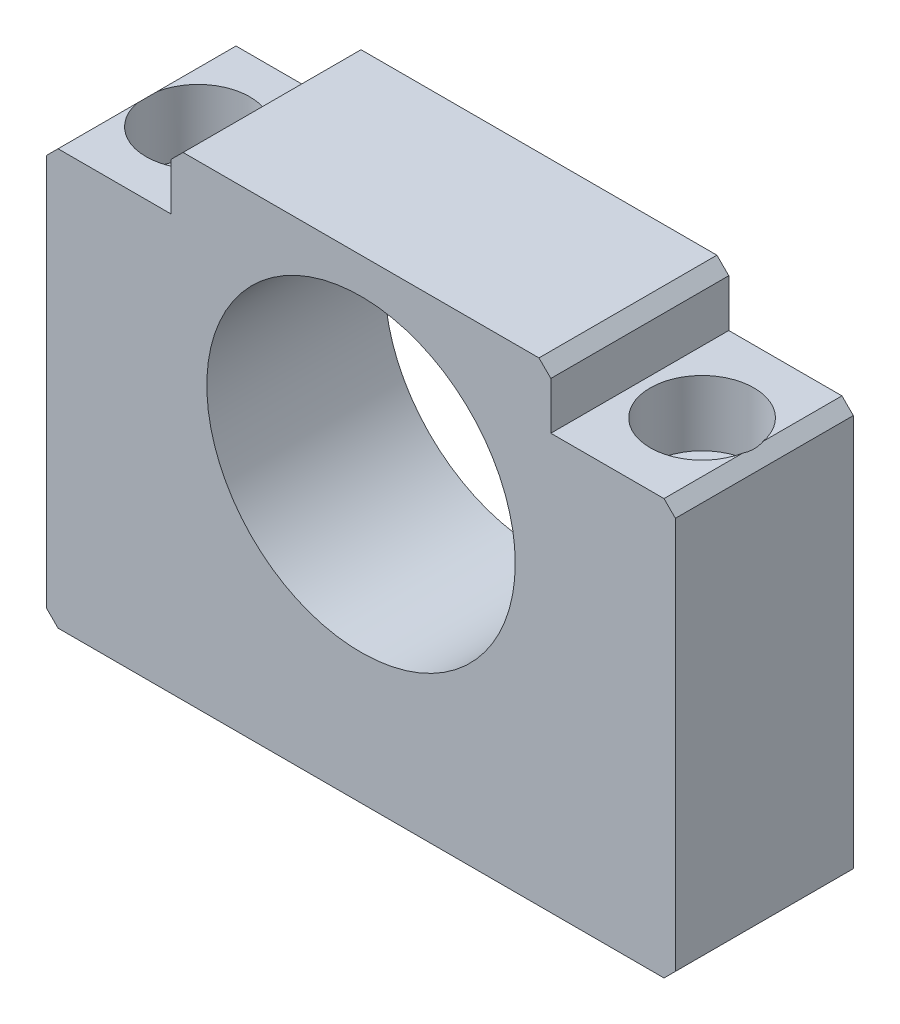
from build123d import *

# Parameters (mm, degrees)
BOSS_EXTRUDE1_DEPTH = 30
SKETCH4_R           = 26
CUT_EXTRUDE1_DEPTH  = 30


with BuildPart() as part:
    # Sketch1 → Boss-Extrude1 (new body)
    with BuildSketch(Plane.XY):
        Polygon((-53, -46.08), (-51.08, -48), (51.08, -48), (53, -46.08), (53, 20.08), (51.08, 22), (32, 22), (32, 30), (30, 32), (-30, 32), (-32, 30), (-32, 22), (-51.08, 22), (-53, 20.08), align=None)
    extrude(amount=-BOSS_EXTRUDE1_DEPTH)

    # Sketch2 → Cut-Revolve1 (revolve, cut)
    with BuildSketch(Plane(origin=(42.5, 0, 0), x_dir=(0, 0, -1), z_dir=(1, 0, 0)), mode=Mode.PRIVATE) as cut_revolve1_sk:
        Polygon((15, 22), (23.75, 22), (23.75, 11), (20.5, 11), (20.5, -48), (15, -48), align=None)
    revolve(cut_revolve1_sk.sketch.rotate(Axis((42.5, -48, -15), (0, 1, 0)), 180), axis=Axis((42.5, -48, -15), (0, 1, 0)), mode=Mode.SUBTRACT)

    # Sketch3 → Cut-Revolve2 (revolve, cut)
    with BuildSketch(Plane(origin=(-42.5, 0, 0), x_dir=(0, 0, -1), z_dir=(1, 0, 0)), mode=Mode.PRIVATE) as cut_revolve2_sk:
        Polygon((15, 22), (23.75, 22), (23.75, 11), (20.5, 11), (20.5, -48), (15, -48), align=None)
    revolve(cut_revolve2_sk.sketch.rotate(Axis((-42.5, -48, -15), (0, 1, 0)), 180), axis=Axis((-42.5, -48, -15), (0, 1, 0)), mode=Mode.SUBTRACT)

    # Sketch4 → Cut-Extrude1 (cut)
    with BuildSketch(Plane.XY):
        Circle(SKETCH4_R)
    extrude(amount=-CUT_EXTRUDE1_DEPTH, mode=Mode.SUBTRACT)


solid = part.part
